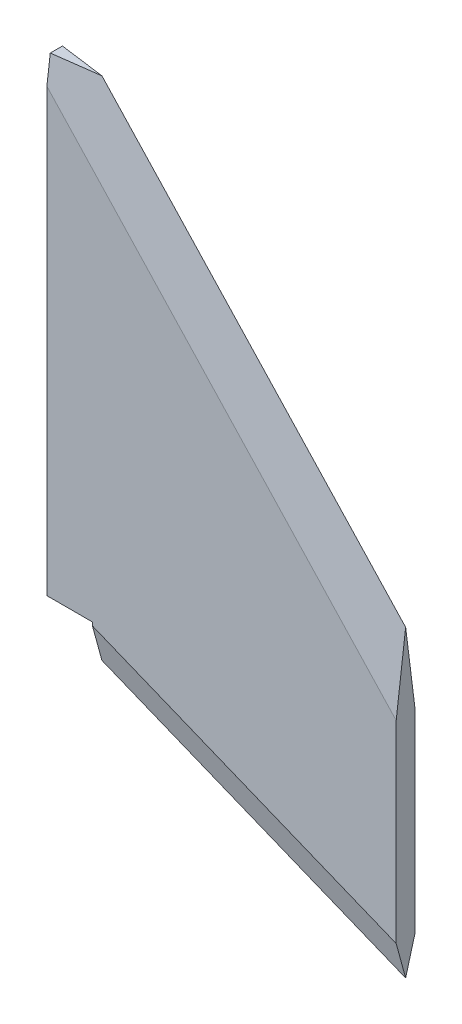
from build123d import *

# Parameters (mm, degrees)
SKETCH2_W                = 11.43
SKETCH2_H                = 117.475
BOSS_EXTRUDE3_DEPTH      = 4.7498
CUT_EXTRUDE17_DEPTH      = 5.08
CUT_EXTRUDE17_DEPTH_BACK = 101.6
CUT_EXTRUDE18_DEPTH      = 101.6
CUT_EXTRUDE18_DEPTH_BACK = 127


with BuildPart() as part:
    # Sketch2 → Boss-Extrude3 (new body)
    with BuildSketch(Plane.XY):
        Polygon((76.2, -30.9118), (0, 0), (0, 127), (76.2, 45.2882), align=None)
        with Locations((-5.715, 68.2625)):
            Rectangle(SKETCH2_W, SKETCH2_H)
    extrude(amount=BOSS_EXTRUDE3_DEPTH)

    # Sketch8 → Cut-Extrude17 (cut, two sides: drawn at the far end of the back side and taken through both)
    with BuildSketch(Plane(origin=(0, 0, 0), x_dir=(0, 0, -1), z_dir=(-0.9266549506898317, 0.37591302499650847, 0)).offset(-CUT_EXTRUDE17_DEPTH_BACK)):
        Polygon((-2.3749, 0), (3e-09, -8.038518146), (0.750296228, -8.038518146), (0.750296228, 2.310233708), (-5.314343575, 2.310233708), (-5.314343575, -8.038518146), (-4.749800003, -8.038518146), align=None)
    extrude(amount=CUT_EXTRUDE17_DEPTH + CUT_EXTRUDE17_DEPTH_BACK, mode=Mode.SUBTRACT)

    # Sketch9 → Cut-Extrude18 (cut, two sides: drawn at the far end of the back side and taken through both)
    with BuildSketch(Plane(origin=(12.854537069, -13.784348584, 0), x_dir=(0, 0, -1), z_dir=(0.6820103942193665, -0.731342479401234, 0)).offset(-CUT_EXTRUDE18_DEPTH_BACK)):
        Polygon((-2.3749, 86.615320066), (0, 73.622586943), (0.872559858, 73.622586943), (0.872559858, 91.301528403), (-6.531219552, 91.301528403), (-6.531219552, 73.622586943), (-4.7498, 73.622586943), align=None)
    extrude(amount=CUT_EXTRUDE18_DEPTH + CUT_EXTRUDE18_DEPTH_BACK, mode=Mode.SUBTRACT)


solid = part.part
